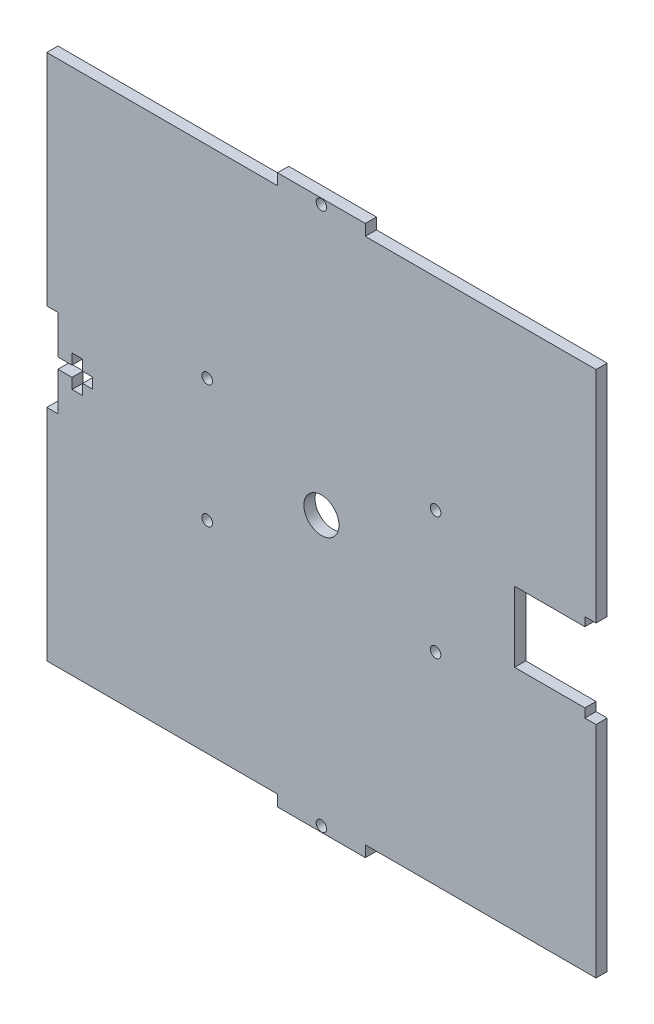
from build123d import *

# Parameters (mm, degrees)
SKETCH1_R           = 1.5
BOSS_EXTRUDE1_DEPTH = 3.18
SKETCH2_R           = 1.5
CUT_EXTRUDE1_DEPTH  = 10
SKETCH3_R           = 5
CUT_EXTRUDE2_DEPTH  = 10
SKETCH4_W           = 20
SKETCH4_H           = 20
CUT_EXTRUDE3_DEPTH  = 10


with BuildPart() as part:
    # Sketch1 → Boss-Extrude1 (new body)
    with BuildSketch(Plane.XY):
        Polygon((-78.18, 75), (-12.5, 75), (-12.5, 78.18), (12.5, 78.18), (12.5, 75), (78.18, 75), (78.18, 12.5), (75, 12.5), (75, 1.5), (71, 1.5), (71, 4.5), (68, 4.5), (68, 1.5), (65.18, 1.5), (65.18, -1.5), (68, -1.5), (68, -4.5), (71, -4.5), (71, -1.5), (75, -1.5), (75, -12.5), (78.18, -12.5), (78.18, -75), (12.5, -75), (12.5, -78.18), (-12.5, -78.18), (-12.5, -75), (-78.18, -75), (-78.18, -12.5), (-75, -12.5), (-75, -1.5), (-71, -1.5), (-71, -4.5), (-68, -4.5), (-68, -1.5), (-65.18, -1.5), (-65.18, 1.5), (-68, 1.5), (-68, 4.5), (-71, 4.5), (-71, 1.5), (-75, 1.5), (-75, 12.5), (-78.18, 12.5), align=None)
        with Locations(Location((0, -76.59, 0), (0, 0, 180))):
            Circle(SKETCH1_R, mode=Mode.SUBTRACT)
        with Locations(Location((0, 76.59, 0), (0, 0, 180))):
            Circle(SKETCH1_R, mode=Mode.SUBTRACT)
    extrude(amount=BOSS_EXTRUDE1_DEPTH)

    # Sketch2 → Cut-Extrude1 (cut)
    with BuildSketch(Plane.XY.offset(3.18)):
        with Locations((32.5, 17.5)):
            Circle(SKETCH2_R)
        with Locations((32.5, -17.5)):
            Circle(SKETCH2_R)
        with Locations((-32.5, 17.5)):
            Circle(SKETCH2_R)
        with Locations((-32.5, -17.5)):
            Circle(SKETCH2_R)
    extrude(amount=-CUT_EXTRUDE1_DEPTH, mode=Mode.SUBTRACT)

    # Sketch3 → Cut-Extrude2 (cut)
    with BuildSketch(Plane.XY.offset(3.18)):
        Circle(SKETCH3_R)
    extrude(amount=-CUT_EXTRUDE2_DEPTH, mode=Mode.SUBTRACT)

    # Sketch4 → Cut-Extrude3 (cut)
    with BuildSketch(Plane.XY.offset(3.18)):
        with Locations((65, 0)):
            Rectangle(SKETCH4_W, SKETCH4_H)
    extrude(amount=-CUT_EXTRUDE3_DEPTH, mode=Mode.SUBTRACT)


solid = part.part
